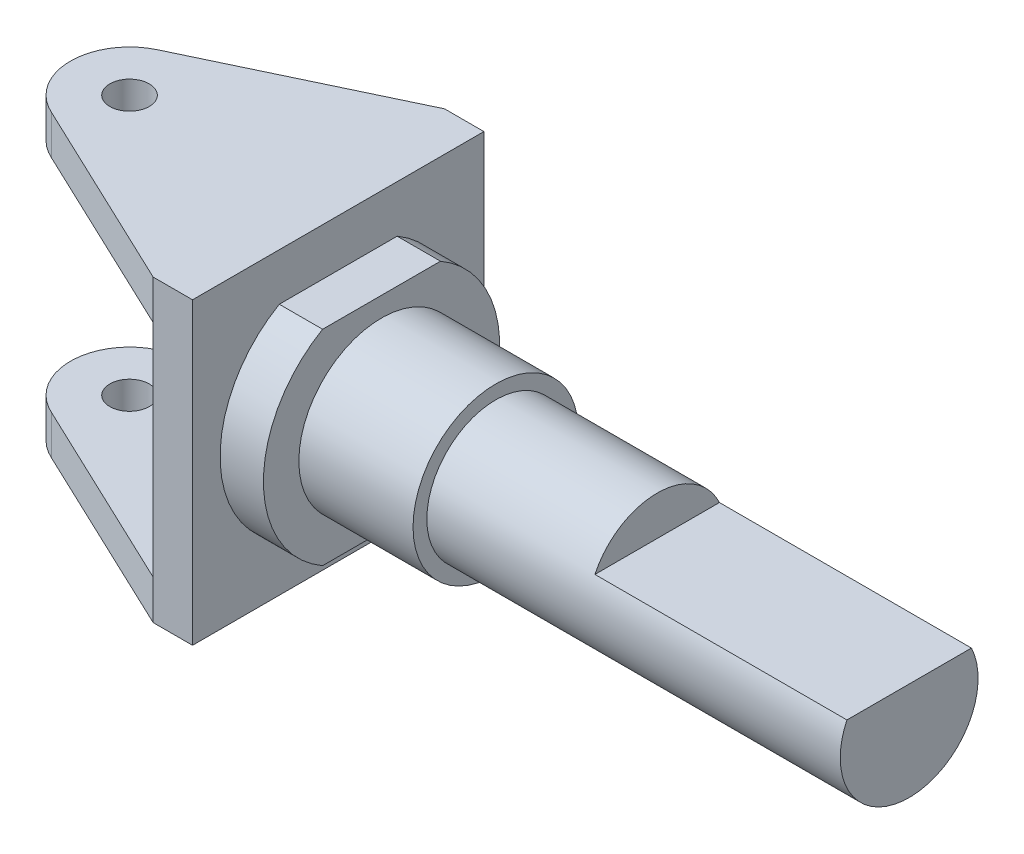
from build123d import *

# Parameters (mm, degrees)
CUT_EXTRUDE_1_DEPTH = 64
CUT_EXTRUDE_START   = -64
CUT_EXTRUDE_2_DEPTH = 64
SKETCH_4_W          = 74
SKETCH_4_H          = 76
EXTRUDE_1_DEPTH     = 10
EXTRUDE_START       = -66
SKETCH_5_R          = 5
EXTRUDE_2_DEPTH     = 10
SKETCH_5_3_R        = 5
EXTRUDE_3_DEPTH     = 10


with BuildPart() as part:
    # 스케치1 → 회전1 (revolve)
    with BuildSketch(Plane(origin=(0, 0, 0), x_dir=(1, 0, 0), z_dir=(0, 1, 0))):
        Polygon((74.878584377, 0), (-70.121415623, 0), (-70.121415623, -30), (-59.121415623, -30), (-59.121415623, -21), (-30.121415623, -21), (-30.121415623, -17.5), (74.878584377, -17.5), align=None)
    revolve(axis=Axis((-70.121415623, 0, 0), (1, 0, 0)))

    # 스케치2 → 컷-돌출1 (cut)
    with BuildSketch(Plane(origin=(74.878584377, 0, 0), x_dir=(0, 0, -1), z_dir=(1, 0, 0))):
        with BuildLine():
            ThreePointArc((15.811388301, 7.5), (0, 17.5), (-15.811388301, 7.5))
            Line((-15.811388301, 7.5), (15.811388301, 7.5))
        make_face()
    extrude(amount=-CUT_EXTRUDE_1_DEPTH, mode=Mode.SUBTRACT)

    # 스케치3 → 컷-돌출2 (cut)
    with BuildSketch(Plane.ZY.offset(70.121415623).offset(CUT_EXTRUDE_START)):
        with BuildLine():
            ThreePointArc((14.966629547, 26), (0, 30), (-14.966629547, 26))
            Line((-14.966629547, 26), (14.966629547, 26))
        make_face()
        with BuildLine():
            Line((14.966629547, -26), (-14.966629547, -26))
            ThreePointArc((-14.966629547, -26), (0, -30), (14.966629547, -26))
        make_face()
    extrude(amount=CUT_EXTRUDE_2_DEPTH, mode=Mode.SUBTRACT)

    # 스케치4 → 보스-돌출1 (add)
    with BuildSketch(Plane.ZY.offset(70.121415623)):
        Rectangle(SKETCH_4_W, SKETCH_4_H)
    extrude(amount=EXTRUDE_1_DEPTH)

    # 스케치5 → 보스-돌출2 (add)
    with BuildSketch(Plane(origin=(0, 38, 0), x_dir=(1, 0, 0), z_dir=(0, 1, 0)).offset(EXTRUDE_START)):
        with BuildLine():
            Line((-80.121415623, -37), (-80.121415623, 37))
            Line((-80.121415623, 37), (-129.550289518, 13.552475067))
            ThreePointArc((-129.550289518, 13.552475067), (-138.120501498, -0.165598609), (-129.249504521, -13.691111221))
            Line((-129.249504521, -13.691111221), (-80.121415623, -37))
        make_face()
        with Locations((-123.121415623, 0)):
            Circle(SKETCH_5_R, mode=Mode.SUBTRACT)
    extrude(amount=-EXTRUDE_2_DEPTH)

    # 스케치5<3> → 보스-돌출3 (add)
    with BuildSketch(Plane(origin=(0, 38, 0), x_dir=(1, 0, 0), z_dir=(0, 1, 0))):
        with BuildLine():
            Line((-80.121415623, -37), (-80.121415623, 37))
            Line((-80.121415623, 37), (-129.550289518, 13.552475067))
            ThreePointArc((-129.550289518, 13.552475067), (-138.120501498, -0.165598609), (-129.249504521, -13.691111221))
            Line((-129.249504521, -13.691111221), (-80.121415623, -37))
        make_face()
        with Locations((-123.121415623, 0)):
            Circle(SKETCH_5_3_R, mode=Mode.SUBTRACT)
    extrude(amount=-EXTRUDE_3_DEPTH)


solid = part.part
